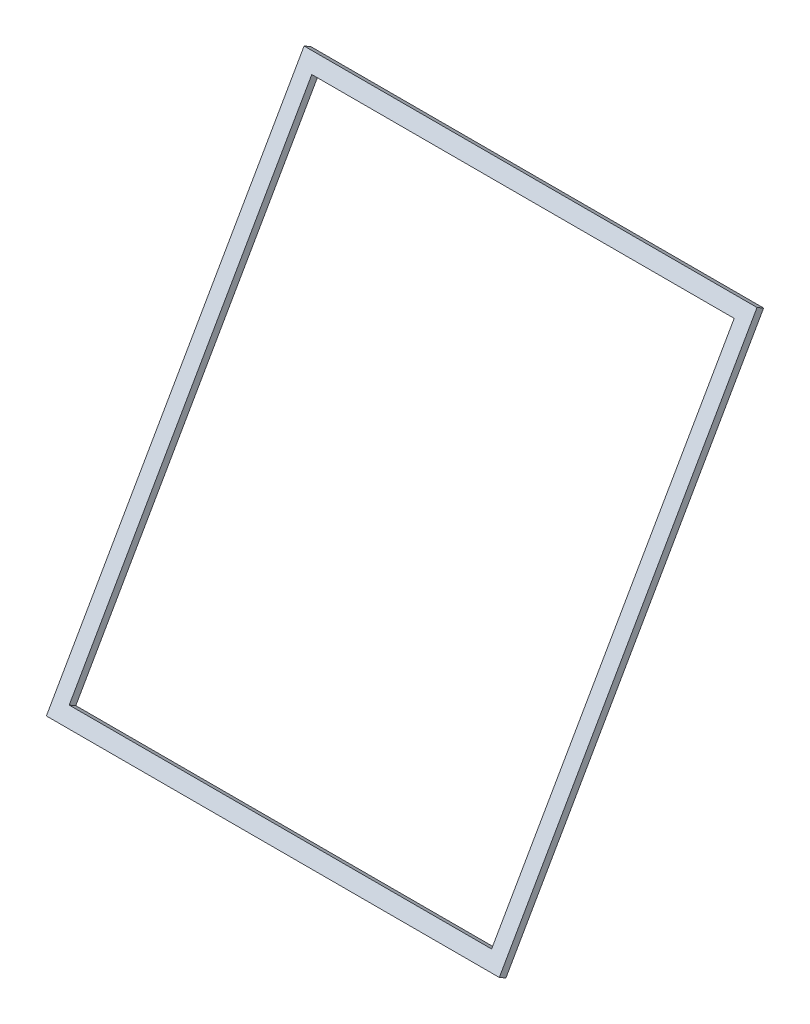
from build123d import *

# Parameters (mm, degrees)
CROQUIS2_W              = 296.787285623
CROQUIS2_H              = 340.570123561
CROQUIS2_W_2            = 276.787285623
CROQUIS2_H_2            = 320.570123561
SALIENTE_EXTRUIR1_DEPTH = 5


with BuildPart() as part:
    # Croquis2 → Saliente-Extruir1 (new body)
    with BuildSketch(Plane(origin=(0, 37.26764048, 65.265664801), x_dir=(-1, 0, 0), z_dir=(0, -0.4958678423378191, -0.8683979980027797))):
        with Locations((7.754092984, -20.861611505)):
            Rectangle(CROQUIS2_W, CROQUIS2_H)
        with Locations((7.754092984, -20.861611505)):
            Rectangle(CROQUIS2_W_2, CROQUIS2_H_2, mode=Mode.SUBTRACT)
    extrude(amount=-SALIENTE_EXTRUIR1_DEPTH)


solid = part.part
